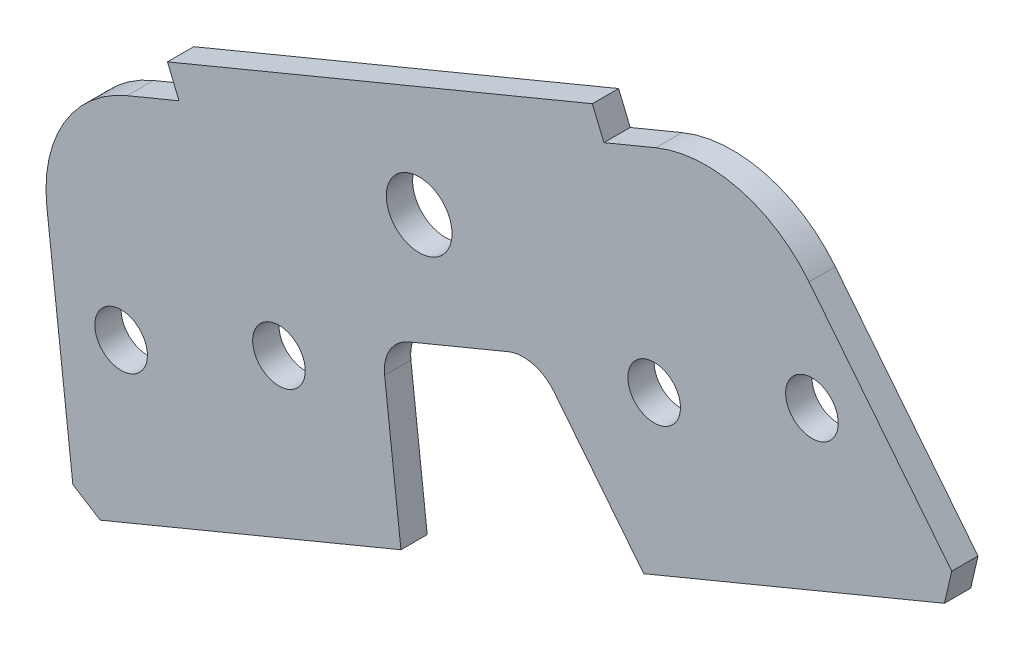
from build123d import *

# Parameters (mm, degrees)
SKETCH_1_W          = 178.1038796
SKETCH_1_H          = 112.631890056
EXTRUDE_1_DEPTH     = 2
SKETCH_2_OUTSIDE_W  = 222.252
SKETCH_2_OUTSIDE_H  = 156.78
CUT_EXTRUDE_1_DEPTH = 2
SKETCH_3_R          = 2
CUT_EXTRUDE_2_DEPTH = 2
SKETCH_4_R          = 2
CUT_EXTRUDE_3_DEPTH = 10
SKETCH_5_R          = 2.5
CUT_EXTRUDE_4_DEPTH = 10


with BuildPart() as part:
    # 草图1 → 凸台-拉伸1 (new body)
    with BuildSketch(Plane.XY):
        Rectangle(SKETCH_1_W, SKETCH_1_H)
    extrude(amount=EXTRUDE_1_DEPTH)

    # 草图2 outside → 切除-拉伸1 (cut)
    with BuildSketch(Plane.XY.offset(2)):
        Rectangle(SKETCH_2_OUTSIDE_W, SKETCH_2_OUTSIDE_H)
        with BuildLine():
            Line((19.419678114, -9.00835621), (26.240314518, -17.576109786))
            Line((26.240314518, -17.576109786), (49.120442624, -8.088240876))
            Line((49.120442624, -8.088240876), (49.672051155, -5.694361888))
            Line((49.672051155, -5.694361888), (38.815198664, 7.943491127))
            ThreePointArc((38.815198664, 7.943491127), (33.491549784, 11.397714714), (27.161091097, 10.952528456))
            Line((27.161091097, 10.952528456), (23.209000469, 9.31368633))
            Line((23.209000469, 9.31368633), (22.32798775, 11.438260779))
            Line((22.32798775, 11.438260779), (-10.002492997, -1.968454504))
            Line((-10.002492997, -1.968454504), (-9.121480278, -4.093028953))
            Line((-9.121480278, -4.093028953), (-13.073570906, -5.731871079))
            ThreePointArc((-13.073570906, -5.731871079), (-17.86138023, -9.897177774), (-19.178350627, -16.105115191))
            Line((-19.178350627, -16.105115191), (-17.198178577, -33.42392576))
            Line((-17.198178577, -33.42392576), (-15.114374014, -34.724958857))
            Line((-15.114374014, -34.724958857), (7.765754091, -25.237089947))
            Line((7.765754091, -25.237089947), (6.521744045, -14.356836213))
            ThreePointArc((6.521744045, -14.356836213), (6.916835164, -12.494454989), (8.353177961, -11.24486298))
            Line((8.353177961, -11.24486298), (15.923445844, -8.105645011))
            ThreePointArc((15.923445844, -8.105645011), (17.82258345, -7.972089134), (19.419678114, -9.00835621))
        make_face(mode=Mode.SUBTRACT)
    extrude(amount=-CUT_EXTRUDE_1_DEPTH, mode=Mode.SUBTRACT)

    # 草图3 → 切除-拉伸2 (cut)
    with BuildSketch(Plane.XY.offset(2)):
        with Locations((39.039313187, -0.266244108)):
            Circle(SKETCH_3_R)
        with Locations((-13.526945878, -22.064276566)):
            Circle(SKETCH_3_R)
    extrude(amount=-CUT_EXTRUDE_2_DEPTH, mode=Mode.SUBTRACT)

    # 草图4 → 切除-拉伸3 (cut)
    with BuildSketch(Plane.XY.offset(2)):
        with Locations((-1.5184816, -17.084639461)):
            Circle(SKETCH_4_R)
        with Locations((27.030848909, -5.245881212)):
            Circle(SKETCH_4_R)
    extrude(amount=-CUT_EXTRUDE_3_DEPTH, mode=Mode.SUBTRACT)

    # 草图5 → 切除-拉伸4 (cut)
    with BuildSketch(Plane.XY.offset(2)):
        with Locations((9.15052964, -2.470175429)):
            Circle(SKETCH_5_R)
    extrude(amount=-CUT_EXTRUDE_4_DEPTH, mode=Mode.SUBTRACT)


solid = part.part
